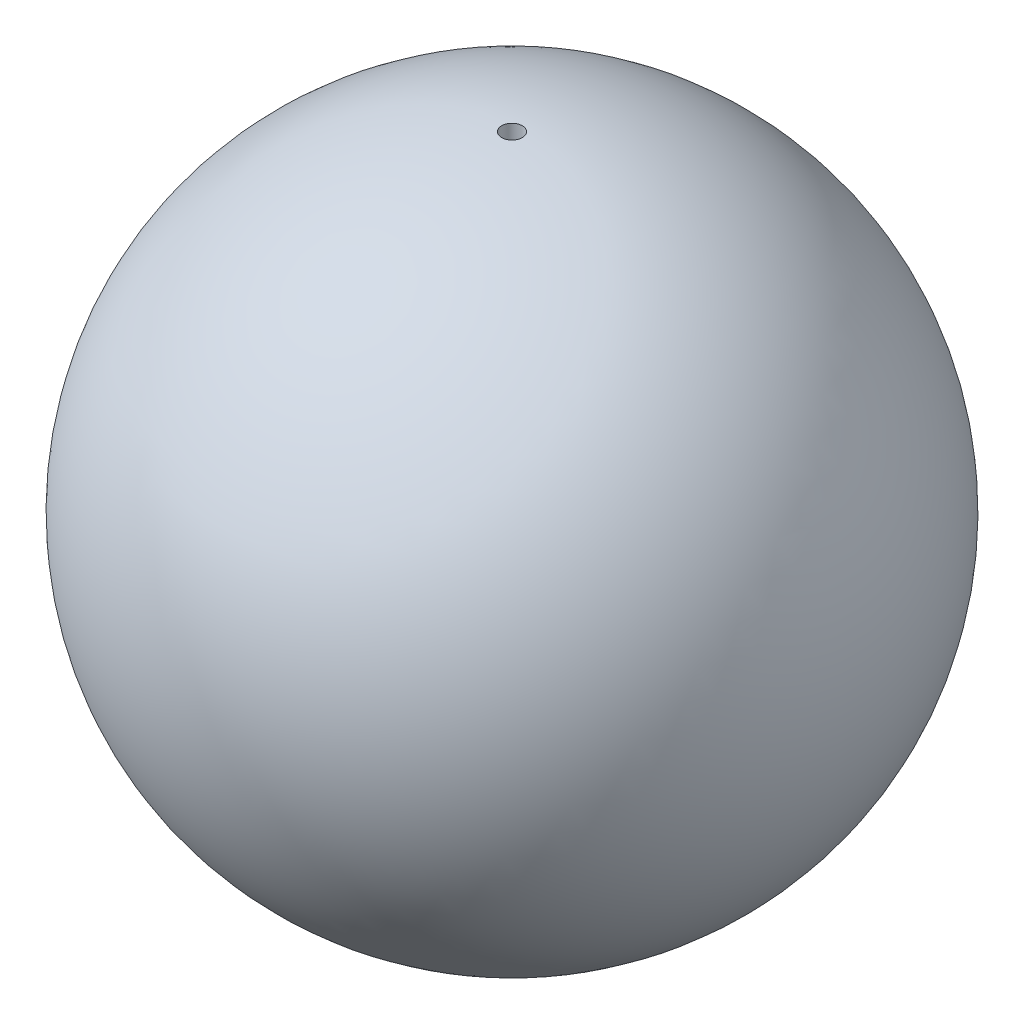
from build123d import *

# Parameters (mm, degrees)
CUT_EXTRUDE1_DEPTH      = 352.952724098
CUT_EXTRUDE1_DEPTH_BACK = 352.952724098
SKETCH2_R               = 6.35


with BuildPart() as part:
    # Sketch1 → Revolve2 (revolve)
    with BuildSketch(Plane.XY):
        with BuildLine():
            Line((0, 203.2), (0, -203.2))
            ThreePointArc((0, -203.2), (-203.2, 0), (0, 203.2))
        make_face()
    revolve(axis=Axis((0, 203.2, 0), (0, -1, 0)))

    # Sketch2 → Cut-Extrude1 (cut, two sides: drawn at the far end of the back side and taken through both)
    with BuildSketch(Plane(origin=(0, 0, 0), x_dir=(1, 0, 0), z_dir=(0, 1, 0)).offset(-CUT_EXTRUDE1_DEPTH_BACK)):
        Circle(SKETCH2_R)
    extrude(amount=CUT_EXTRUDE1_DEPTH + CUT_EXTRUDE1_DEPTH_BACK, mode=Mode.SUBTRACT)


solid = part.part
